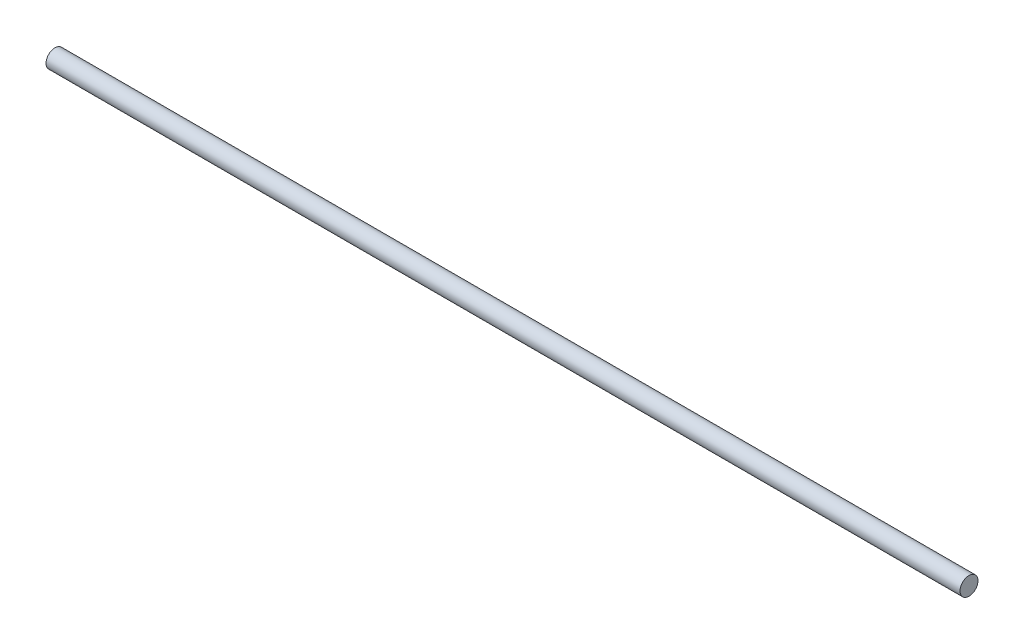
from build123d import *

# Parameters (mm, degrees)
SKETCH1_R           = 6
BOSS_EXTRUDE1_DEPTH = 304.8


with BuildPart() as part:
    # Sketch1 → Boss-Extrude1 (new, symmetric)
    with BuildSketch(Plane(origin=(0, 0, 0), x_dir=(0, 0, -1), z_dir=(1, 0, 0))):
        with Locations(Location((0, 0, 0), (0, 0, 180))):
            Circle(SKETCH1_R)
    extrude(amount=BOSS_EXTRUDE1_DEPTH, both=True)


solid = part.part
